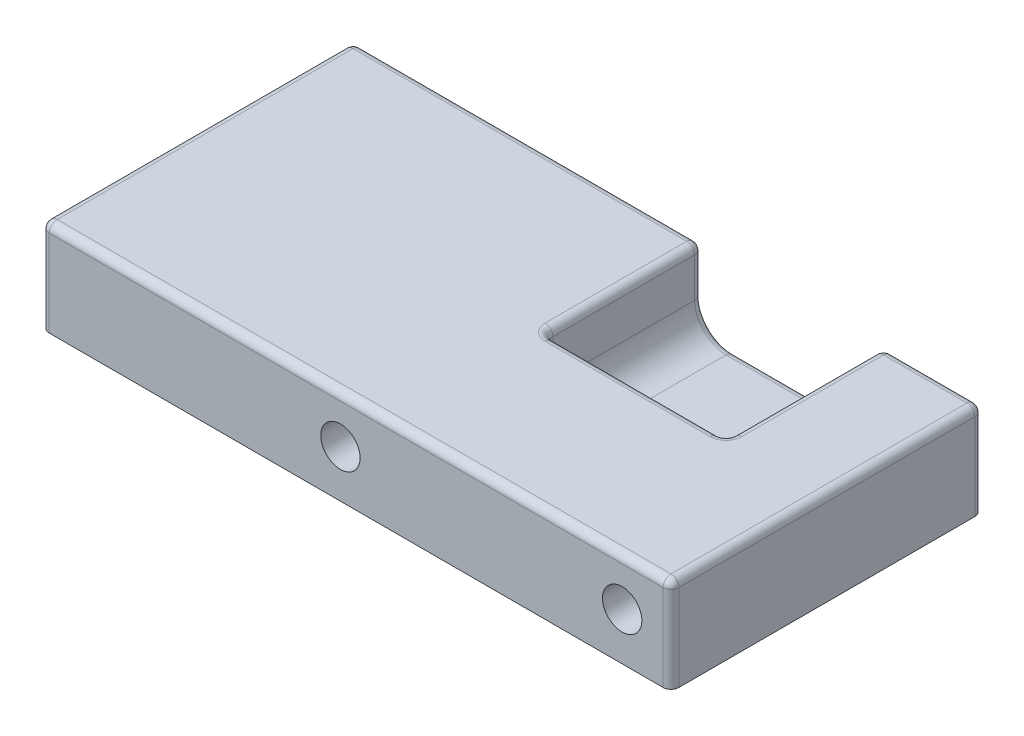
from build123d import *

# Parameters (mm, degrees)
SKETCH1_W           = 80
SKETCH1_H           = 39.6
BOSS_EXTRUDE1_DEPTH = 12
CUT_EXTRUDE2_REACH  = 92.068
SKETCH2_R           = 2.5
CUT_EXTRUDE3_DEPTH  = 20
FILLET1_R           = 1


with BuildPart() as part:
    # Sketch1 → Boss-Extrude1 (new body)
    with BuildSketch(Plane(origin=(0, 0, 0), x_dir=(1, 0, 0), z_dir=(0, 1, 0))):
        with Locations((40, 19.8)):
            Rectangle(SKETCH1_W, SKETCH1_H)
    extrude(amount=BOSS_EXTRUDE1_DEPTH)

    # Sketch2 → Cut-Extrude2 (cut, up to next)
    with BuildSketch(Plane(origin=(0, 0, -39.6), x_dir=(-1, 0, 0), z_dir=(0, 0, -1)), mode=Mode.PRIVATE) as cut_extrude2_sk1:
        with Locations((-38, 6)):
            Circle(SKETCH2_R)
    cut_extrude2_tool1 = extrude(cut_extrude2_sk1.sketch, amount=-CUT_EXTRUDE2_REACH, mode=Mode.PRIVATE) & part.part
    # Sketch2 → Cut-Extrude2 (cut, up to next)
    with BuildSketch(Plane(origin=(0, 0, -39.6), x_dir=(-1, 0, 0), z_dir=(0, 0, -1)), mode=Mode.PRIVATE) as cut_extrude2_sk2:
        with Locations((-73.8, 6)):
            Circle(SKETCH2_R)
    cut_extrude2_tool2 = extrude(cut_extrude2_sk2.sketch, amount=-CUT_EXTRUDE2_REACH, mode=Mode.PRIVATE) & part.part
    add(cut_extrude2_tool1.solids().sort_by_distance((38, 6, -39.6))[0], mode=Mode.SUBTRACT)
    add(cut_extrude2_tool2.solids().sort_by_distance((73.8, 6, -39.6))[0], mode=Mode.SUBTRACT)

    # Sketch3 → Cut-Extrude3 (cut)
    with BuildSketch(Plane(origin=(0, 0, -39.6), x_dir=(-1, 0, 0), z_dir=(0, 0, -1))):
        with BuildLine():
            Line((-63.4, 2), (-48.4, 2))
            ThreePointArc((-48.4, 2), (-45.571572875, 3.171572875), (-44.4, 6))
            Line((-44.4, 6), (-44.4, 12))
            Line((-44.4, 12), (-67.4, 12))
            Line((-67.4, 12), (-67.4, 6))
            ThreePointArc((-67.4, 6), (-66.228427125, 3.171572875), (-63.4, 2))
        make_face()
    extrude(amount=-CUT_EXTRUDE3_DEPTH, mode=Mode.SUBTRACT)

    # Fillet1
    fillet1_edges = [part.edges().sort_by_distance(p)[0] for p in [
        (80, 12, -19.8),
        (73.7, 12, -39.6),
        (22.2, 12, -39.6),
        (66.228427125, 3.171572875, -19.6),
        (67.4, 9, -19.6),
        (55.9, 12, -19.6),
        (67.4, 12, -29.6),
        (44.4, 9, -19.6),
        (44.4, 12, -29.6),
        (45.571572875, 3.171572875, -19.6),
        (55.9, 2, -19.6),
        (66.228427125, 3.171572875, -39.6),
        (55.9, 2, -39.6),
        (45.571572875, 3.171572875, -39.6),
        (44.4, 9, -39.6),
        (67.4, 9, -39.6),
        (0, 12, -19.8),
        (40, 12, 0),
        (0, 6, -39.6),
        (80, 6, -39.6),
        (80, 6, 0),
        (0, 6, 0),
    ]]
    fillet(fillet1_edges, radius=FILLET1_R)


solid = part.part
